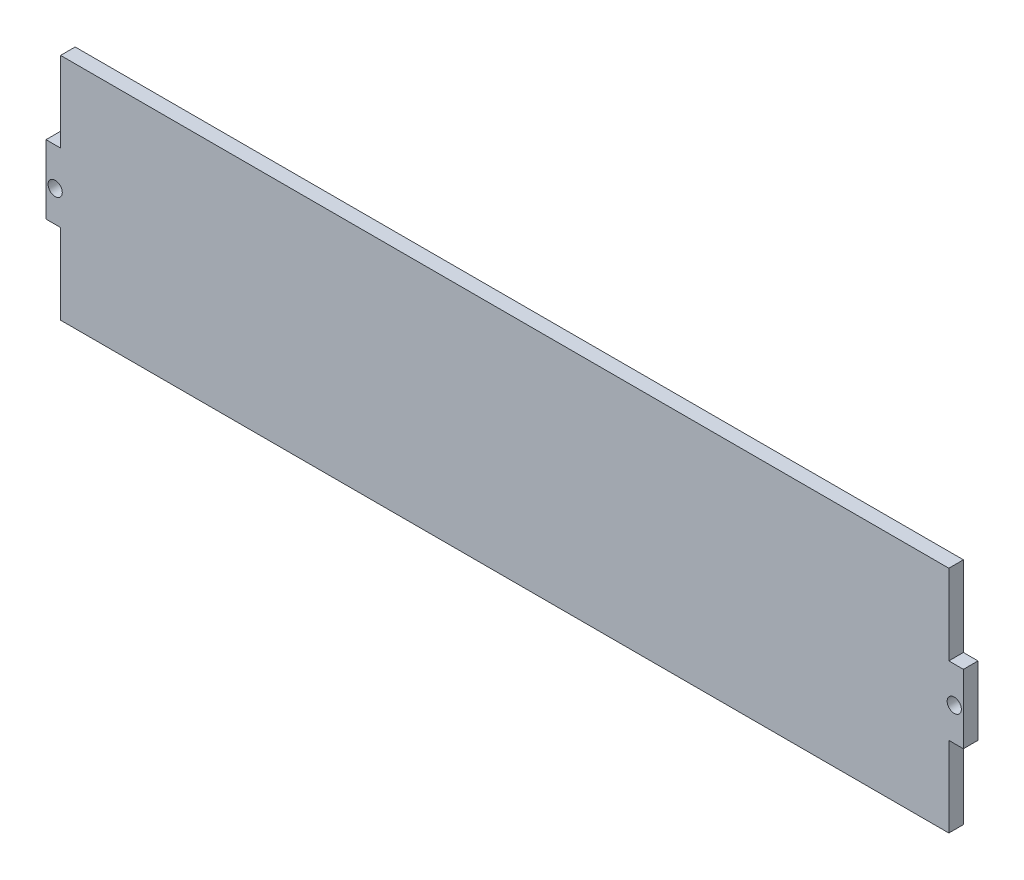
from build123d import *

# Parameters (mm, degrees)
SKETCH1_W           = 200
SKETCH1_H           = 50
BOSS_EXTRUDE2_DEPTH = 3.18
SKETCH3_W           = 3.18
SKETCH3_H           = 17.5
CUT_EXTRUDE1_DEPTH  = 104.12668132
SKETCH4_R           = 1.55
CUT_EXTRUDE2_DEPTH  = 104.12668132


with BuildPart() as part:
    # Sketch1 → Boss-Extrude2 (new body)
    with BuildSketch(Plane.XY):
        Rectangle(SKETCH1_W, SKETCH1_H)
    extrude(amount=BOSS_EXTRUDE2_DEPTH)

    # Sketch3 → Cut-Extrude1 (cut, through all)
    with BuildSketch(Plane.XY.offset(3.18)):
        with Locations((-98.41, 16.25)):
            Rectangle(SKETCH3_W, SKETCH3_H)
        with Locations((-98.41, -16.25)):
            Rectangle(SKETCH3_W, SKETCH3_H)
        with Locations((98.41, 16.25)):
            Rectangle(SKETCH3_W, SKETCH3_H)
        with Locations((98.41, -16.25)):
            Rectangle(SKETCH3_W, SKETCH3_H)
    extrude(amount=-CUT_EXTRUDE1_DEPTH, mode=Mode.SUBTRACT)

    # Sketch4 → Cut-Extrude2 (cut, through all)
    with BuildSketch(Plane.XY.offset(3.18)):
        with Locations((-98, -0.707640919)):
            Circle(SKETCH4_R)
        with Locations((98.002158409, -0.27875217)):
            Circle(SKETCH4_R)
    extrude(amount=-CUT_EXTRUDE2_DEPTH, mode=Mode.SUBTRACT)


solid = part.part
